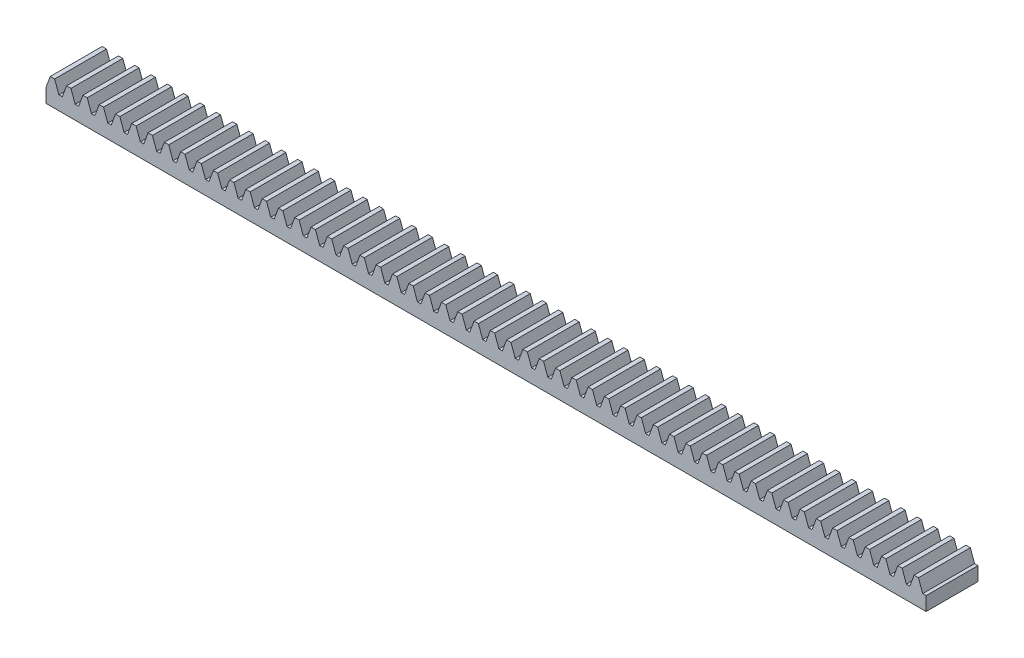
from build123d import *

# Parameters (mm, degrees)
SKETCH_1_W             = 508.938009882
SKETCH_1_H             = 8
EXTRUDE_1_DEPTH        = 30
EXTRUDE_2_DEPTH        = 30
PATTERN_LINEAR_1_COUNT = 54
PATTERN_LINEAR_1_PITCH = 9.424777961


with BuildPart() as part:
    # 草图1 → 拉伸1 (new body)
    with BuildSketch(Plane.XY):
        with Locations((254.469004941, -4)):
            Rectangle(SKETCH_1_W, SKETCH_1_H)
    extrude(amount=EXTRUDE_1_DEPTH)

    # 草图2 → 拉伸2 (add)
    with BuildSketch(Plane.XY.offset(30)):
        Polygon((0, 0), (2.456799081, 6.75), (4.985366656, 6.75), (7.442165737, 0), align=None)
    extrude_2 = extrude(amount=-EXTRUDE_2_DEPTH)

    # 阵列(线性)1: 拉伸2 ×54
    with Locations(*[(i * PATTERN_LINEAR_1_PITCH, 0, 0) for i in range(1, PATTERN_LINEAR_1_COUNT)]):
        add(extrude_2)


solid = part.part
